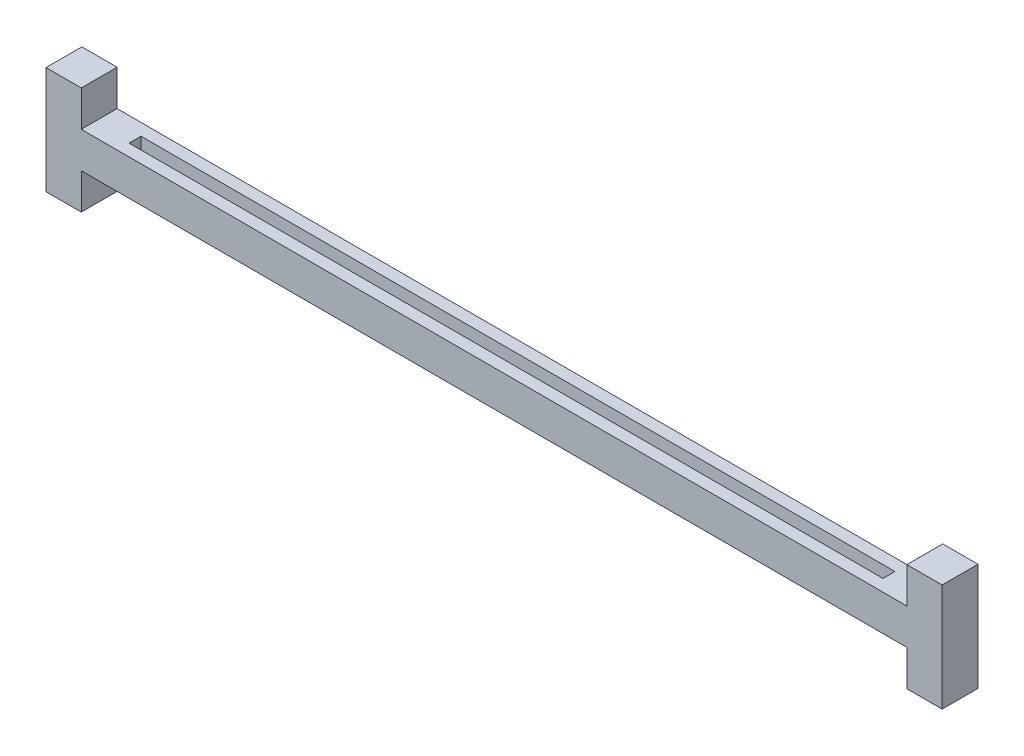
from build123d import *

# Parameters (mm, degrees)
SLIDER_MAIN_BODY_DEPTH = 5
SKETCH4_W              = 105.16
SKETCH4_H              = 1.666666666
CUT_EXTRUDE1_DEPTH     = 64.492125496


with BuildPart() as part:
    # Sketch1 → Slider Main Body (new body)
    with BuildSketch(Plane.XY):
        Polygon((-57.58, 7.5), (-57.58, 2.5), (57.58, 2.5), (57.58, 7.5), (62.5, 7.5), (62.5, -7.5), (57.58, -7.5), (57.58, -2.5), (-57.58, -2.5), (-57.58, -7.5), (-62.5, -7.5), (-62.5, 7.5), align=None)
    extrude(amount=SLIDER_MAIN_BODY_DEPTH)

    # Sketch4 → Cut-Extrude1 (cut, through all)
    with BuildSketch(Plane.XZ.offset(2.5)):
        with Locations((0, 2.5)):
            Rectangle(SKETCH4_W, SKETCH4_H)
    extrude(amount=-CUT_EXTRUDE1_DEPTH, mode=Mode.SUBTRACT)


solid = part.part
